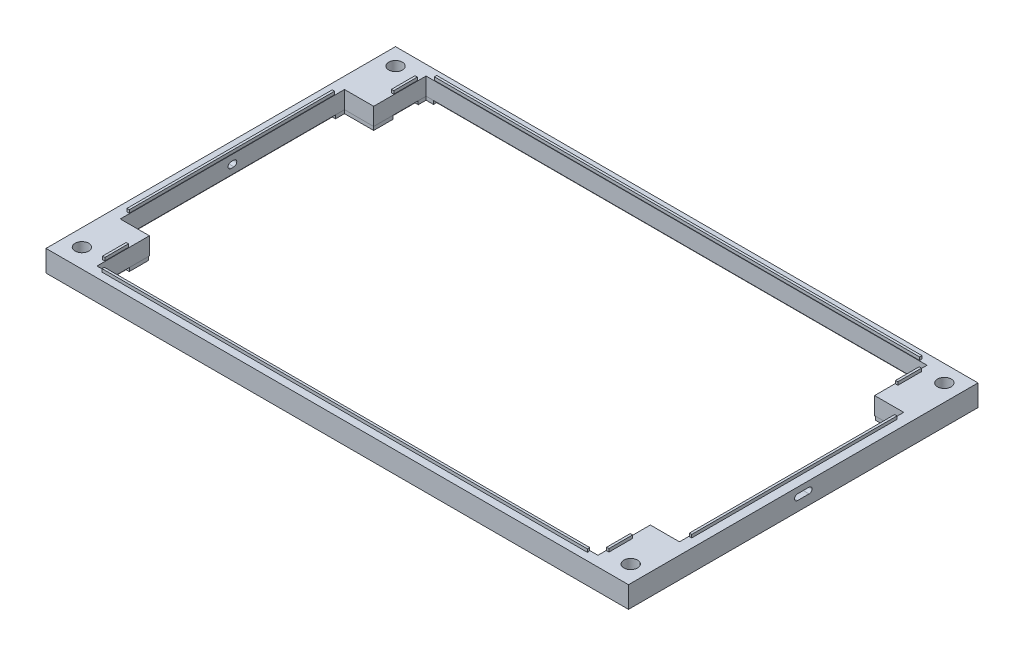
from build123d import *

# Parameters (mm, degrees)
SKETCH8_W           = 200
SKETCH8_H           = 120
SKETCH8_R           = 2.35
BOSS_EXTRUDE4_DEPTH = 1.35
SKETCH9_W           = 200
SKETCH9_H           = 120
SKETCH9_R           = 2.35
BOSS_EXTRUDE5_DEPTH = 6
SKETCH10_W          = 0.8
SKETCH10_H          = 8.103385626
SKETCH10_W_2        = 166.613370644
SKETCH10_H_2        = 0.8
SKETCH10_H_3        = 70.515232796
BOSS_EXTRUDE6_DEPTH = 1.05
CUT_EXTRUDE1_REACH  = 235.389
CUT_EXTRUDE2_REACH  = 235.389


with BuildPart() as part:
    # Sketch8 → Boss-Extrude4 (new body)
    with BuildSketch(Plane(origin=(0, 0, 0), x_dir=(1, 0, 0), z_dir=(0, 1, 0))):
        with Locations((100, 60)):
            Rectangle(SKETCH8_W, SKETCH8_H)
        with Locations(Location((5.806188151, 6.51599975, 0), (0, 0, 90))):
            Circle(SKETCH8_R, mode=Mode.SUBTRACT)
        with Locations(Location((194.233048897, 6.51599975, 0), (0, 0, 90))):
            Circle(SKETCH8_R, mode=Mode.SUBTRACT)
        with Locations(Location((194.233048897, 114.215856496, 0), (0, 0, 90))):
            Circle(SKETCH8_R, mode=Mode.SUBTRACT)
        with Locations(Location((5.806188151, 114.215856496, 0), (0, 0, 90))):
            Circle(SKETCH8_R, mode=Mode.SUBTRACT)
        Polygon((2.75, 95.557616398), (2.75, 24.442383602), (3.85, 24.442383602), (3.85, 21.35), (13.85, 21.35), (13.85, 14.747824367), (12.75, 14.747824367), (12.75, 6.044438741), (13.85, 6.044438741), (13.85, 3.35), (16.393314678, 3.35), (16.393314678, 2.25), (183.606685322, 2.25), (183.606685322, 3.35), (186.15, 3.35), (186.15, 6.044438741), (187.25, 6.044438741), (187.25, 14.747824367), (186.15, 14.747824367), (186.15, 21.35), (196.15, 21.35), (196.15, 24.442383602), (197.25, 24.442383602), (197.25, 95.557616398), (196.15, 95.557616398), (196.15, 98.65), (186.15, 98.65), (186.15, 105.252175633), (187.25, 105.252175633), (187.25, 113.955561259), (186.15, 113.955561259), (186.15, 116.65), (183.606685322, 116.65), (183.606685322, 117.75), (16.393314678, 117.75), (16.393314678, 116.65), (13.85, 116.65), (13.85, 113.955561259), (12.75, 113.955561259), (12.75, 105.252175633), (13.85, 105.252175633), (13.85, 98.65), (3.85, 98.65), (3.85, 95.557616398), align=None, mode=Mode.SUBTRACT)
    extrude(amount=BOSS_EXTRUDE4_DEPTH)

    # Sketch9 → Boss-Extrude5 (add)
    with BuildSketch(Plane(origin=(0, 1.35, 0), x_dir=(1, 0, 0), z_dir=(0, 1, 0))):
        with Locations((100, 60)):
            Rectangle(SKETCH9_W, SKETCH9_H)
        with Locations(Location((194.233048897, 114.215856496, 0), (0, 0, 90))):
            Circle(SKETCH9_R, mode=Mode.SUBTRACT)
        with Locations(Location((194.233048897, 6.51599975, 0), (0, 0, 90))):
            Circle(SKETCH9_R, mode=Mode.SUBTRACT)
        with Locations(Location((5.806188151, 6.51599975, 0), (0, 0, 90))):
            Circle(SKETCH9_R, mode=Mode.SUBTRACT)
        with Locations(Location((5.806188151, 114.215856496, 0), (0, 0, 90))):
            Circle(SKETCH9_R, mode=Mode.SUBTRACT)
        Polygon((183.456685322, 116.5), (186, 116.5), (186, 113.805561259), (186, 105.402175633), (186, 98.5), (196, 98.5), (196, 95.407616398), (196, 24.592383602), (196, 21.5), (186, 21.5), (186, 14.597824367), (186, 6.194438741), (186, 3.5), (183.456685322, 3.5), (16.543314678, 3.5), (14, 3.5), (14, 6.194438741), (14, 14.597824367), (14, 21.5), (4, 21.5), (4, 24.592383602), (4, 95.407616398), (4, 98.5), (14, 98.5), (14, 105.402175633), (14, 113.805561259), (14, 116.5), (16.543314678, 116.5), align=None, mode=Mode.SUBTRACT)
    extrude(amount=BOSS_EXTRUDE5_DEPTH)

    # Sketch10 → Boss-Extrude6 (add)
    with BuildSketch(Plane(origin=(0, 7.35, 0), x_dir=(1, 0, 0), z_dir=(0, 1, 0))):
        with Locations((13.45, 109.603868446)):
            Rectangle(SKETCH10_W, SKETCH10_H)
        with Locations((186.55, 109.603868446)):
            Rectangle(SKETCH10_W, SKETCH10_H)
        with Locations((100, 117.05)):
            Rectangle(SKETCH10_W_2, SKETCH10_H_2)
        with Locations((196.55, 60)):
            Rectangle(SKETCH10_W, SKETCH10_H_3)
        with Locations((186.55, 10.396131554)):
            Rectangle(SKETCH10_W, SKETCH10_H)
        with Locations((100, 2.95)):
            Rectangle(SKETCH10_W_2, SKETCH10_H_2)
        with Locations((13.45, 10.396131554)):
            Rectangle(SKETCH10_W, SKETCH10_H)
        with Locations((3.45, 60)):
            Rectangle(SKETCH10_W, SKETCH10_H_3)
    extrude(amount=BOSS_EXTRUDE6_DEPTH)

    # Sketch11 → Cut-Extrude1 (cut, up to next)
    with BuildSketch(Plane.ZY, mode=Mode.PRIVATE) as cut_extrude1_sk1:
        with BuildLine():
            Line((-60.5, 3.35), (-59.5, 3.35))
            ThreePointArc((-59.5, 3.35), (-58.5, 4.35), (-59.5, 5.35))
            Line((-59.5, 5.35), (-60.5, 5.35))
            ThreePointArc((-60.5, 5.35), (-61.5, 4.35), (-60.5, 3.35))
        make_face()
    cut_extrude1_tool1 = extrude(cut_extrude1_sk1.sketch, amount=-CUT_EXTRUDE1_REACH, mode=Mode.PRIVATE) & part.part
    add(cut_extrude1_tool1.solids().sort_by_distance((0, 4.35, -60))[0], mode=Mode.SUBTRACT)

    # Sketch12 → Cut-Extrude2 (cut, up to next)
    with BuildSketch(Plane(origin=(200, 0, 0), x_dir=(0, 0, -1), z_dir=(1, 0, 0)), mode=Mode.PRIVATE) as cut_extrude2_sk1:
        with BuildLine():
            Line((58, 5.35), (62, 5.35))
            ThreePointArc((62, 5.35), (63, 4.35), (62, 3.35))
            Line((62, 3.35), (58, 3.35))
            ThreePointArc((58, 3.35), (57, 4.35), (58, 5.35))
        make_face()
    cut_extrude2_tool1 = extrude(cut_extrude2_sk1.sketch, amount=-CUT_EXTRUDE2_REACH, mode=Mode.PRIVATE) & part.part
    add(cut_extrude2_tool1.solids().sort_by_distance((200, 4.35, -60))[0], mode=Mode.SUBTRACT)


solid = part.part
